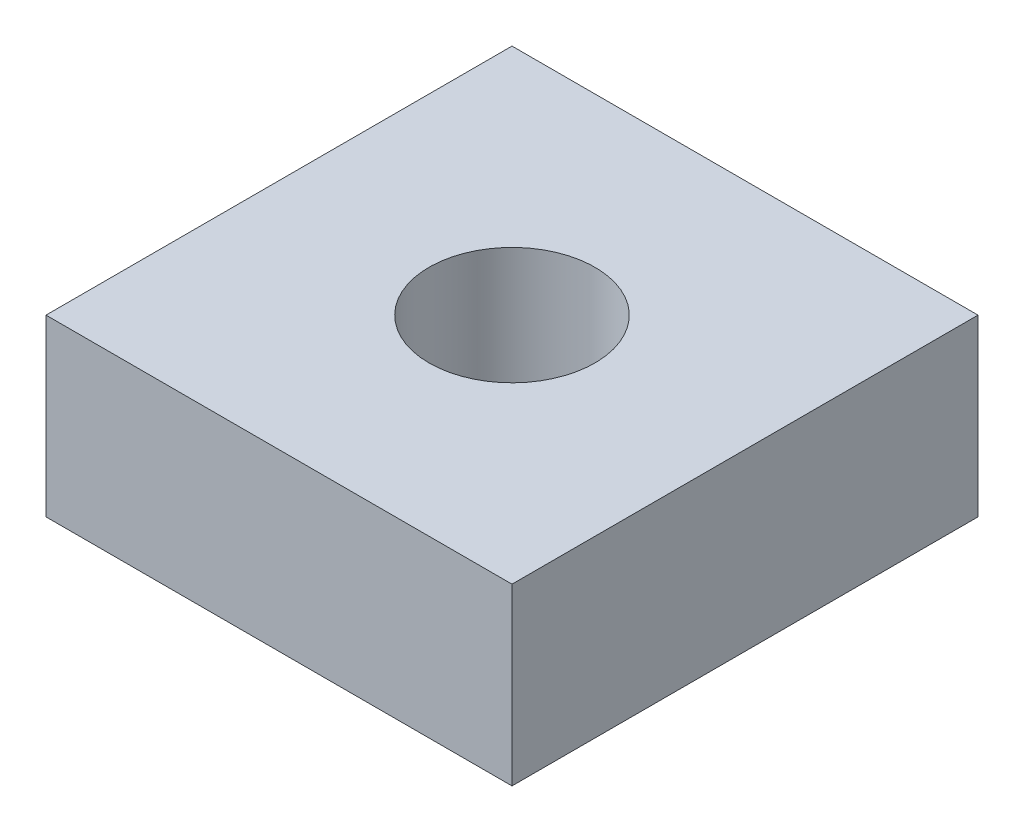
from build123d import *

# Parameters (mm, degrees)
SKETCH1_W             = 6.35
SKETCH1_H             = 6.35
BOSS_EXTRUDE1_DEPTH   = 2.38125
F_4_40_TAPPED_HOLE1_D = 2.2606


with BuildPart() as part:
    # Sketch1 → Boss-Extrude1 (new body)
    with BuildSketch(Plane(origin=(0, 0, 0), x_dir=(1, 0, 0), z_dir=(0, 1, 0))):
        Rectangle(SKETCH1_W, SKETCH1_H)
    extrude(amount=BOSS_EXTRUDE1_DEPTH)

    # #4-40 Tapped Hole1 (through all)
    with Locations(Plane(origin=(0, 2.38125, 0), x_dir=(1, 0, 0), z_dir=(0, 1, 0))):
        with Locations((0, 0)):
            Hole(F_4_40_TAPPED_HOLE1_D / 2)


solid = part.part
